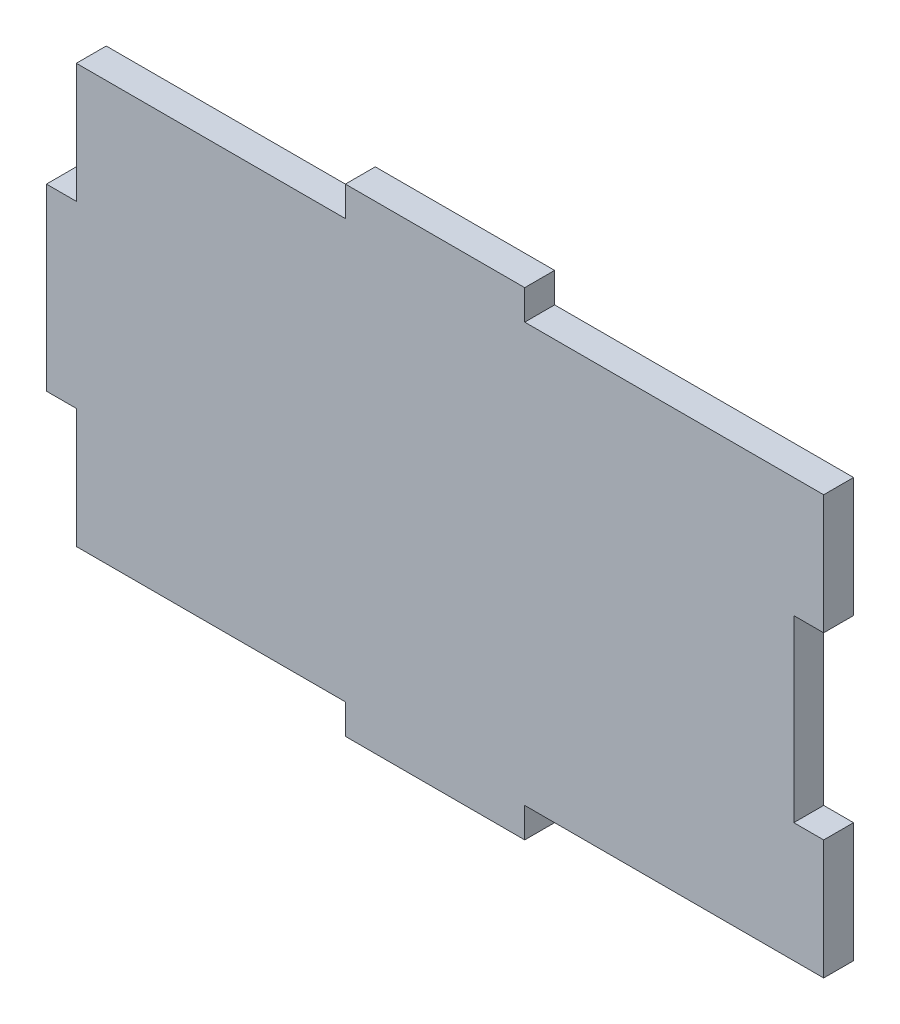
from build123d import *

# Parameters (mm, degrees)
SKETCH1_W           = 79.375
SKETCH1_H           = 44.45
BOSS_EXTRUDE1_DEPTH = 3.175
SKETCH2_W           = 3.175
SKETCH2_H           = 19.05
BOSS_EXTRUDE2_DEPTH = 3.175
SKETCH5_W           = 19.05
SKETCH5_H           = 3.175
BOSS_EXTRUDE3_DEPTH = 3.175
SKETCH3_W           = 3.175
SKETCH3_H           = 19.05
CUT_EXTRUDE1_DEPTH  = 3.175


with BuildPart() as part:
    # Sketch1 → Boss-Extrude1 (new body)
    with BuildSketch(Plane.XY):
        with Locations((39.6875, 22.225)):
            Rectangle(SKETCH1_W, SKETCH1_H)
    extrude(amount=BOSS_EXTRUDE1_DEPTH)

    # Sketch2 → Boss-Extrude2 (add)
    with BuildSketch(Plane.XY.offset(3.175)):
        with Locations((-1.5875, 22.225)):
            Rectangle(SKETCH2_W, SKETCH2_H)
    extrude(amount=-BOSS_EXTRUDE2_DEPTH)

    # Sketch5 → Boss-Extrude3 (add)
    with BuildSketch(Plane.XY.offset(3.175)):
        with Locations((38.1, 46.0375)):
            Rectangle(SKETCH5_W, SKETCH5_H)
        with Locations((38.1, -1.5875)):
            Rectangle(SKETCH5_W, SKETCH5_H)
    extrude(amount=-BOSS_EXTRUDE3_DEPTH)

    # Sketch3 → Cut-Extrude1 (cut)
    with BuildSketch(Plane.XY.offset(3.175)):
        with Locations((77.7875, 22.225)):
            Rectangle(SKETCH3_W, SKETCH3_H)
    extrude(amount=-CUT_EXTRUDE1_DEPTH, mode=Mode.SUBTRACT)


solid = part.part
